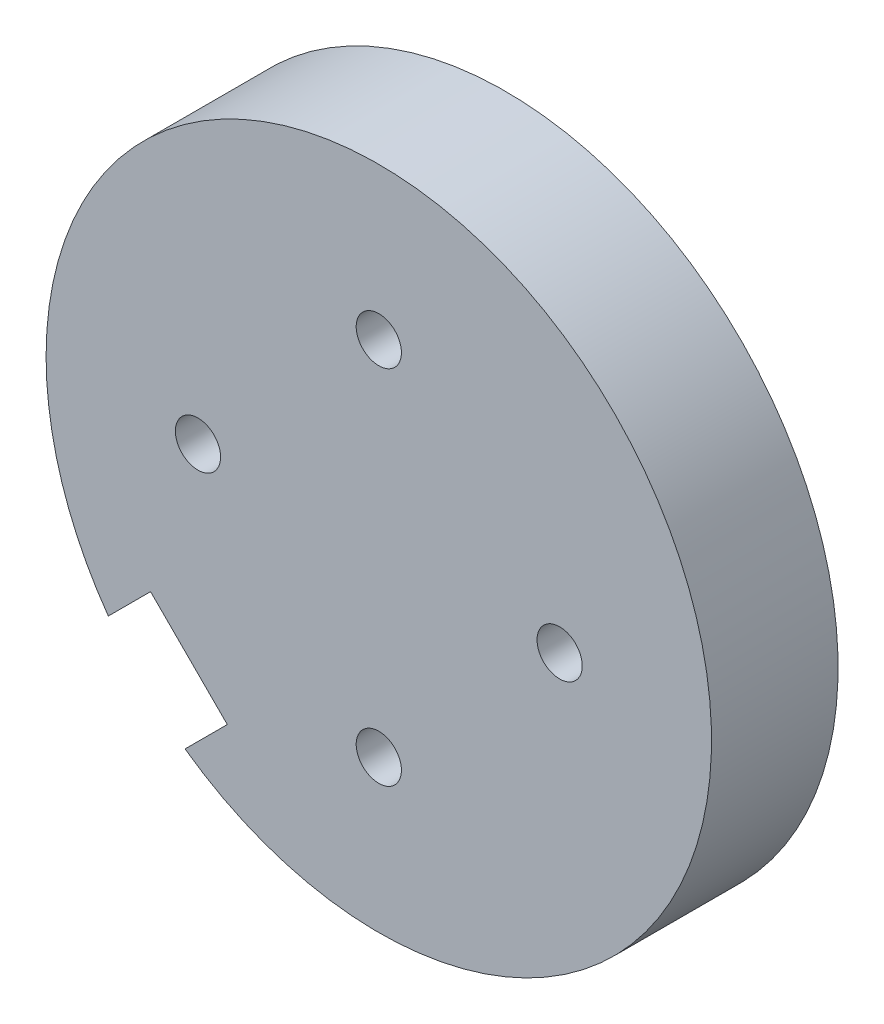
from build123d import *

# Parameters (mm, degrees)
CROQUIS1_R              = 18.4
SALIENTE_EXTRUIR1_DEPTH = 26.3
CORTAR_EXTRUIR1_START   = -5
CROQUIS2_R              = 1.25
CORTAR_EXTRUIR1_DEPTH   = 5
CROQUIS3_R              = 1.25
CORTAR_EXTRUIR2_DEPTH   = 5
CROQUIS7_R              = 18.4
CORTAR_EXTRUIR5_DEPTH   = 19.3
CROQUIS8_R              = 6
CORTAR_EXTRUIR6_DEPTH   = 1


with BuildPart() as part:
    # Croquis1 → Saliente-Extruir1 (new body)
    with BuildSketch(Plane.XY):
        Circle(CROQUIS1_R)
    extrude(amount=SALIENTE_EXTRUIR1_DEPTH)

    # Croquis2 → Cortar-Extruir1 (cut)
    with BuildSketch(Plane.XY.offset(26.3).offset(CORTAR_EXTRUIR1_START)):
        with Locations((0, 10)):
            Circle(CROQUIS2_R)
        with Locations((10, 0)):
            Circle(CROQUIS2_R)
        with Locations((0, -10)):
            Circle(CROQUIS2_R)
        with Locations((-10, 0)):
            Circle(CROQUIS2_R)
        with BuildLine():
            Line((-8.379185723, -12.62182641), (-12.62182641, -8.379185723))
            Line((-12.62182641, -8.379185723), (-14.957986577, -10.71534589))
            ThreePointArc((-14.957986577, -10.71534589), (-13.010764774, -13.010764774), (-10.71534589, -14.957986577))
            Line((-10.71534589, -14.957986577), (-8.379185723, -12.62182641))
        make_face()
    extrude(amount=CORTAR_EXTRUIR1_DEPTH, mode=Mode.SUBTRACT)

    # Croquis3 → Cortar-Extruir2 (cut)
    with BuildSketch(Plane(origin=(0, 0, 0), x_dir=(-1, 0, 0), z_dir=(0, 0, -1))):
        with Locations(Location((-10, 0, 0), (0, 0, 180))):
            Circle(CROQUIS3_R)
        with Locations(Location((0, 10, 0), (0, 0, 180))):
            Circle(CROQUIS3_R)
        with Locations(Location((10, 0, 0), (0, 0, 180))):
            Circle(CROQUIS3_R)
        with Locations(Location((0, -10, 0), (0, 0, 180))):
            Circle(CROQUIS3_R)
    extrude(amount=-CORTAR_EXTRUIR2_DEPTH, mode=Mode.SUBTRACT)

    # Croquis7 → Cortar-Extruir5 (cut)
    with BuildSketch(Plane(origin=(0, 0, 0), x_dir=(-1, 0, 0), z_dir=(0, 0, -1))):
        Circle(CROQUIS7_R)
    extrude(amount=-CORTAR_EXTRUIR5_DEPTH, mode=Mode.SUBTRACT)

    # Croquis8 → Cortar-Extruir6 (cut)
    with BuildSketch(Plane(origin=(0, 0, 19.3), x_dir=(-1, 0, 0), z_dir=(0, 0, -1))):
        Circle(CROQUIS8_R)
    extrude(amount=-CORTAR_EXTRUIR6_DEPTH, mode=Mode.SUBTRACT)


solid = part.part
